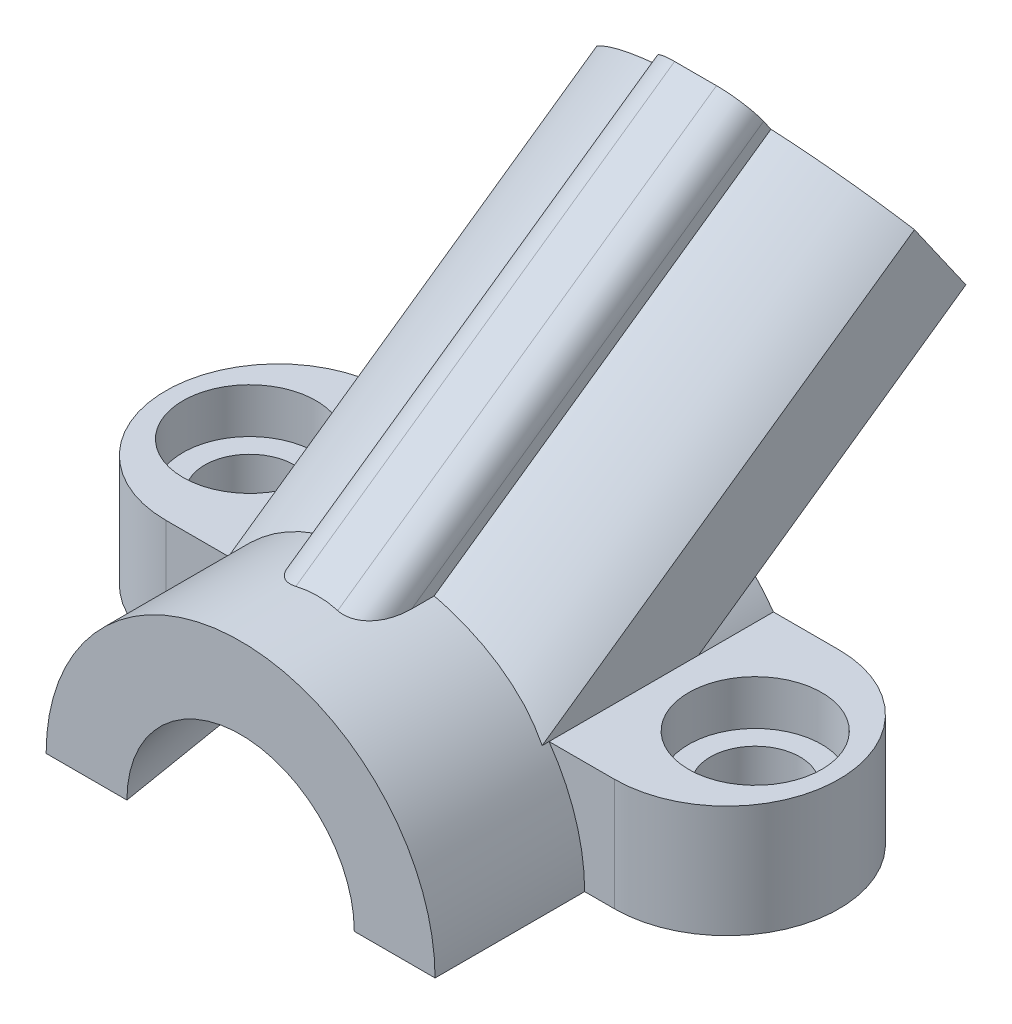
from build123d import *

# Parameters (mm, degrees)
SKETCH1_R             = 13
BOSS_EXTRUDE1_DEPTH   = 25
BOSS_EXTRUDE2_DEPTH   = 7.5
BOSS_EXTRUDE2_2_DEPTH = 7.5
BOSS_EXTRUDE3_DEPTH   = 15
SKETCH5_R             = 3
CUT_EXTRUDE1_DEPTH    = 40.389084782
SKETCH6_R             = 4.45
CUT_EXTRUDE2_DEPTH    = 3
SKETCH7_R             = 4
CUT_EXTRUDE3_DEPTH    = 7.5
BOSS_EXTRUDE6_REACH   = 57.809
SKETCH10_R            = 1.6
CUT_EXTRUDE4_DEPTH    = 56.808932723
SKETCH11_R            = 3.1
CUT_EXTRUDE5_DEPTH    = 48.070587643
SKETCH12_W            = 50
SKETCH12_H            = 50
CUT_EXTRUDE8_DEPTH    = 54.659969844


with BuildPart() as part:
    # Sketch1 → Boss-Extrude1 (new body)
    with BuildSketch(Plane.XY):
        Circle(SKETCH1_R)
    extrude(amount=-BOSS_EXTRUDE1_DEPTH)

    # Sketch2 → Cut-Revolve1 (revolve, cut)
    with BuildSketch(Plane(origin=(0, 0, 0), x_dir=(0, 0, -1), z_dir=(1, 0, 0))):
        Polygon((0, 0), (0, 7.6), (11.5, 9.5), (14, 10.6), (25, 11), (25, 0), align=None)
    revolve(axis=Axis((0, 0, -25), (0, 0, 1)), mode=Mode.SUBTRACT)



with BuildPart() as body_2:
    # Sketch3 → Boss-Extrude2 (new, symmetric)
    with BuildSketch(Plane(origin=(0, 0, 0), x_dir=(1, 0, 0), z_dir=(0, 1, 0))):
        with BuildLine():
            Line((-13, 25), (-13, 10))
            Line((-13, 10), (-15, 10))
            ThreePointArc((-15, 10), (-22.5, 17.5), (-15, 25))
            Line((-15, 25), (-13, 25))
        make_face()
    extrude(amount=BOSS_EXTRUDE2_DEPTH, both=True)


with BuildPart() as body_3:
    # Sketch3 → Boss-Extrude2 2 (new, symmetric)
    with BuildSketch(Plane(origin=(0, 0, 0), x_dir=(1, 0, 0), z_dir=(0, 1, 0))):
        with BuildLine():
            Line((13, 25), (15, 25))
            ThreePointArc((15, 25), (22.5, 17.5), (15, 10))
            Line((15, 10), (13, 10))
            Line((13, 10), (13, 25))
        make_face()
    extrude(amount=BOSS_EXTRUDE2_2_DEPTH, both=True)


with BuildPart() as part_1:
    add(part.part)

    add(body_2.part)  # Boss-Extrude3 merges body 2

    add(body_3.part)  # Boss-Extrude3 merges body 3
    # Sketch4 → Boss-Extrude3 (add)
    with BuildSketch(Plane(origin=(0, 0, -25), x_dir=(-1, 0, 0), z_dir=(0, 0, -1))):
        with BuildLine():
            Line((-13, 7.5), (-13, -7.5))
            Line((-13, -7.5), (-8.04673847, -7.5))
            ThreePointArc((-8.04673847, -7.5), (-11, 0), (-8.04673847, 7.5))
            Line((-8.04673847, 7.5), (-13, 7.5))
        make_face()
        with BuildLine():
            Line((13, 7.5), (13, -7.5))
            Line((13, -7.5), (8.04673847, -7.5))
            ThreePointArc((8.04673847, -7.5), (11, 0), (8.04673847, 7.5))
            Line((8.04673847, 7.5), (13, 7.5))
        make_face()
    extrude(amount=-BOSS_EXTRUDE3_DEPTH)

    # Sketch5 → Cut-Extrude1 (cut, through all)
    with BuildSketch(Plane(origin=(0, 7.5, 0), x_dir=(1, 0, 0), z_dir=(0, 1, 0))):
        with Locations((16.9, 17.5)):
            Circle(SKETCH5_R)
        with Locations((-16.9, 17.5)):
            Circle(SKETCH5_R)
    extrude(amount=-CUT_EXTRUDE1_DEPTH, mode=Mode.SUBTRACT)

    # Sketch6 → Cut-Extrude2 (cut)
    with BuildSketch(Plane(origin=(0, 7.5, 0), x_dir=(1, 0, 0), z_dir=(0, 1, 0))):
        with Locations((-16.9, 17.5)):
            Circle(SKETCH6_R)
        with Locations((16.9, 17.5)):
            Circle(SKETCH6_R)
    extrude(amount=-CUT_EXTRUDE2_DEPTH, mode=Mode.SUBTRACT)

    # Sketch7 → Cut-Extrude3 (cut)
    with BuildSketch(Plane.XZ.offset(7.5)):
        with Locations((-16.9, -17.5)):
            Circle(SKETCH7_R)
        with Locations((16.9, -17.5)):
            Circle(SKETCH7_R)
    extrude(amount=-CUT_EXTRUDE3_DEPTH, mode=Mode.SUBTRACT)

    # Sketch9 → Boss-Extrude6 (add, up to next)
    with BuildSketch(Plane(origin=(0, 24.373180657, -34.808509373), x_dir=(1, 0, 0), z_dir=(0, 0.5735764363510444, -0.819152044288993)), mode=Mode.PRIVATE) as boss_extrude6_sk1:
        with BuildLine():
            Line((-10.62, 5.324042616), (10.62, 5.324042616))
            Line((10.62, 5.324042616), (10.62, -0.669893629))
            ThreePointArc((10.62, -0.669893629), (7.308881484, -3.260182231), (3.4, -4.807355917))
            Line((3.4, -4.807355917), (3.4, -5.665957384))
            ThreePointArc((3.4, -5.665957384), (2.814213562, -7.080170946), (1.4, -7.665957384))
            Line((1.4, -7.665957384), (-1.4, -7.665957384))
            ThreePointArc((-1.4, -7.665957384), (-2.814213562, -7.080170946), (-3.4, -5.665957384))
            Line((-3.4, -5.665957384), (-3.4, -4.807355917))
            ThreePointArc((-3.4, -4.807355917), (-7.308881484, -3.260182231), (-10.62, -0.669893629))
            Line((-10.62, -0.669893629), (-10.62, 5.324042616))
        make_face()
    boss_extrude6_tool1 = extrude(boss_extrude6_sk1.sketch, amount=-BOSS_EXTRUDE6_REACH, mode=Mode.PRIVATE) - part_1.part
    add(boss_extrude6_tool1.solids().sort_by_distance((0, 24.258264, -34.888975))[0])

    # Sketch10 → Cut-Extrude4 (cut, through all)
    with BuildSketch(Plane(origin=(0, 24.373180657, -34.808509373), x_dir=(-1, 0, 0), z_dir=(0, 0.5735764363510444, -0.819152044288993))):
        with Locations((-4, -0.484042616)):
            Circle(SKETCH10_R)
        with Locations((4, -0.484042616)):
            Circle(SKETCH10_R)
    extrude(amount=-CUT_EXTRUDE4_DEPTH, mode=Mode.SUBTRACT)

    # Sketch11 → Cut-Extrude5 (cut, through all)
    with BuildSketch(Plane(origin=(0, 18.637416293, -26.61698893), x_dir=(1, 0, 0), z_dir=(0, 0.5735764363510444, -0.819152044288993))):
        with Locations((4, 0.484042616)):
            Circle(SKETCH11_R)
        with Locations((-4, 0.484042616)):
            Circle(SKETCH11_R)
    extrude(amount=-CUT_EXTRUDE5_DEPTH, mode=Mode.SUBTRACT)

    # Sketch12 → Cut-Extrude8 (cut, through all)
    with BuildSketch(Plane(origin=(0, 0, 0), x_dir=(1, 0, 0), z_dir=(0, 1, 0))):
        with Locations((0, 14.017641389)):
            Rectangle(SKETCH12_W, SKETCH12_H)
    extrude(amount=-CUT_EXTRUDE8_DEPTH, mode=Mode.SUBTRACT)


solid = part_1.part
